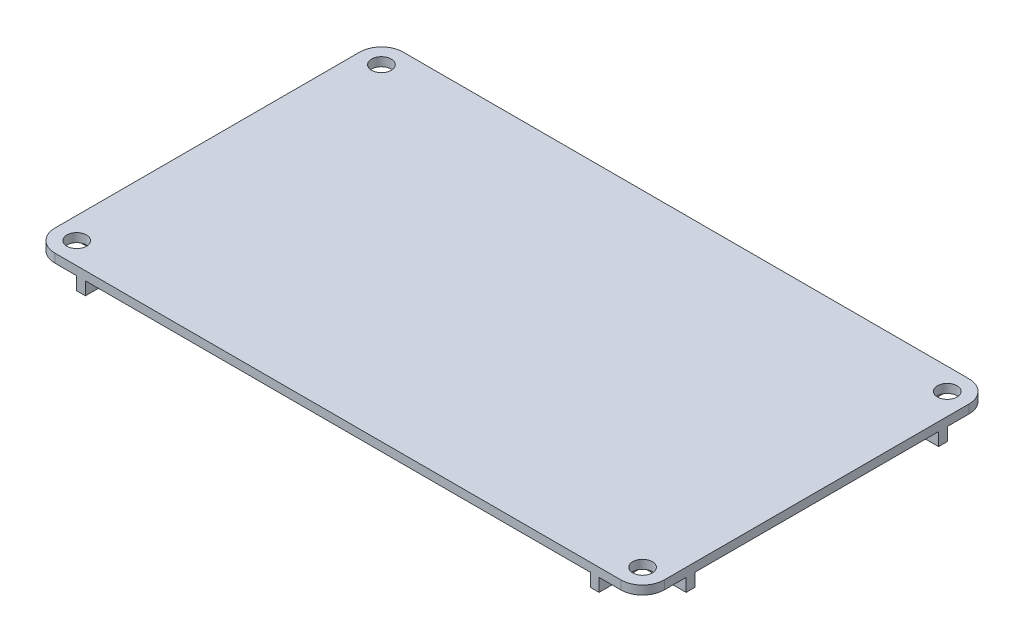
from build123d import *

# Parameters (mm, degrees)
SKETCH1_W           = 140
SKETCH1_H           = 80
SKETCH1_R           = 2.25
BOSS_EXTRUDE4_DEPTH = 2
BOSS_EXTRUDE5_DEPTH = 3
FILLET1_R           = 5


with BuildPart() as part:
    # Sketch1 → Boss-Extrude4 (new body)
    with BuildSketch(Plane(origin=(0, 0, 0), x_dir=(1, 0, 0), z_dir=(0, 1, 0))):
        Rectangle(SKETCH1_W, SKETCH1_H)
        with Locations((65, 35)):
            Circle(SKETCH1_R, mode=Mode.SUBTRACT)
        with Locations((65, -35)):
            Circle(SKETCH1_R, mode=Mode.SUBTRACT)
        with Locations((-65, -35)):
            Circle(SKETCH1_R, mode=Mode.SUBTRACT)
        with Locations((-65, 35)):
            Circle(SKETCH1_R, mode=Mode.SUBTRACT)
    extrude(amount=BOSS_EXTRUDE4_DEPTH)

    # Sketch1<5> → Boss-Extrude5 (add)
    with BuildSketch(Plane(origin=(0, 0, 0), x_dir=(1, 0, 0), z_dir=(0, 1, 0))):
        Polygon((70, 28), (70, 30), (60, 30), (60, 40), (58, 40), (58, 28), align=None)
        Polygon((70, -30), (70, -28), (58, -28), (58, -40), (60, -40), (60, -30), align=None)
        Polygon((-58, 28), (-58, 40), (-60, 40), (-60, 30), (-70, 30), (-70, 28), align=None)
        Polygon((-60, -40), (-58, -40), (-58, -28), (-70, -28), (-70, -30), (-60, -30), align=None)
    extrude(amount=-BOSS_EXTRUDE5_DEPTH)

    # Fillet1
    fillet1_edges = [part.edges().sort_by_distance(p)[0] for p in [
        (70, 1, -40),
        (-70, 1, -40),
        (-70, 1, 40),
        (70, 1, 40),
    ]]
    fillet(fillet1_edges, radius=FILLET1_R)


solid = part.part
